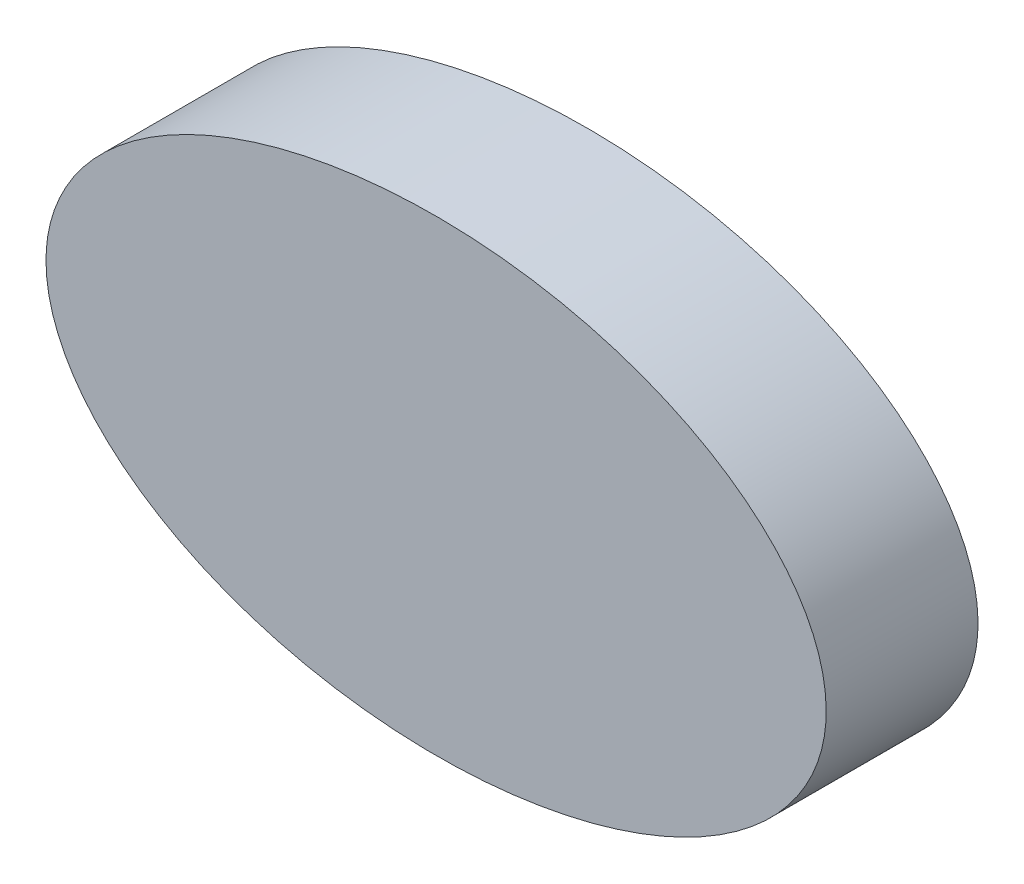
from build123d import *

# Parameters (mm, degrees)
ESQUISSE1_RX       = 42.418
ESQUISSE1_RY       = 25.4
BOSS_EXTRU_1_DEPTH = 16.51


with BuildPart() as part:
    # Esquisse1 → Boss.-Extru.1 (new body)
    with BuildSketch(Plane.XY):
        with Locations(Location((0, 0), (0, 0, 180))):
            Ellipse(ESQUISSE1_RX, ESQUISSE1_RY)
    extrude(amount=BOSS_EXTRU_1_DEPTH)


solid = part.part
